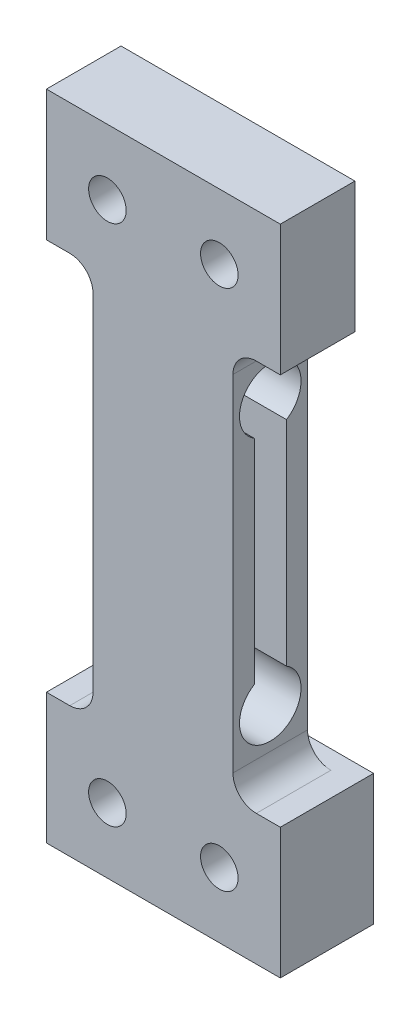
from build123d import *

# Parameters (mm, degrees)
SKETCH1_W           = 12.538434267
SKETCH1_H           = 35
BOSS_EXTRUDE1_DEPTH = 4
SKETCH2_W           = 2.538434267
SKETCH2_H           = 21
CUT_EXTRUDE1_DEPTH  = 37.619666847
SKETCH3_W           = 2.5
SKETCH3_H           = 21
CUT_EXTRUDE2_DEPTH  = 37.619666847
CUT_EXTRUDE3_DEPTH  = 37.619666847
SKETCH5_W           = 7.5
SKETCH5_H           = 1.65
SKETCH6_W           = 7.5
SKETCH6_H           = 1.65
HOLE1_D             = 2.013
FILLET1_R           = 1.25
SKETCH9_W           = 12.538434267
SKETCH9_H           = 7
BOSS_EXTRUDE2_DEPTH = 1


with BuildPart() as part:
    # Sketch1 → Boss-Extrude1 (new body)
    with BuildSketch(Plane(origin=(0, 0, 0), x_dir=(-1, 0, 0), z_dir=(0, 0, -1))):
        with Locations((3.730782867, 17.5)):
            Rectangle(SKETCH1_W, SKETCH1_H)
    extrude(amount=-BOSS_EXTRUDE1_DEPTH)

    # Sketch2 → Cut-Extrude1 (cut, through all)
    with BuildSketch(Plane.XY.offset(4)):
        with Locations((1.269217133, 17.5)):
            Rectangle(SKETCH2_W, SKETCH2_H)
    extrude(amount=-CUT_EXTRUDE1_DEPTH, mode=Mode.SUBTRACT)

    # Sketch3 → Cut-Extrude2 (cut, through all)
    with BuildSketch(Plane.XY.offset(4)):
        with Locations((-8.75, 17.5)):
            Rectangle(SKETCH3_W, SKETCH3_H)
    extrude(amount=-CUT_EXTRUDE2_DEPTH, mode=Mode.SUBTRACT)

    # Sketch4 → Cut-Extrude3 (cut, through all)
    with BuildSketch(Plane(origin=(0, 0, 0), x_dir=(0, 0, -1), z_dir=(1, 0, 0))):
        with BuildLine():
            Line((-2.855933763, 23.21436986), (-2.855933763, 11.78563014))
            ThreePointArc((-2.855933763, 11.78563014), (-1.992824856, 12.024984399), (-1.13183027, 11.778132681))
            Line((-1.13183027, 11.778132681), (-1.13183027, 23.221867319))
            ThreePointArc((-1.13183027, 23.221867319), (-1.992824856, 22.975015601), (-2.855933763, 23.21436986))
        make_face()
    extrude(amount=-CUT_EXTRUDE3_DEPTH, mode=Mode.SUBTRACT)

    # Sketch5 → Cut-Revolve1 (revolve, cut)
    with BuildSketch(Plane.XY.offset(2)):
        with Locations((-3.75, 11.2)):
            Rectangle(SKETCH5_W, SKETCH5_H)
    revolve(axis=Axis((-7.5, 10.375, 2), (1, 0, 0)), mode=Mode.SUBTRACT)

    # Sketch6 → Cut-Revolve2 (revolve, cut)
    with BuildSketch(Plane.XY.offset(2)):
        with Locations((-3.75, 25.45)):
            Rectangle(SKETCH6_W, SKETCH6_H)
    revolve(axis=Axis((-7.5, 24.625, 2), (1, 0, 0)), mode=Mode.SUBTRACT)

    # Hole1 (through all)
    with Locations(Plane(origin=(0, 0, 0), x_dir=(-1, 0, 0), z_dir=(0, 0, -1))):
        with Locations((0.730782866, 3.5), (6.730782866, 3.5), (0.730782866, 31.5), (6.730782866, 31.5)):
            Hole(HOLE1_D / 2)

    # Fillet1
    fillet1_edges = [part.edges().sort_by_distance(p)[0] for p in [
        (0, 7, 2),
        (0, 28, 2),
        (-7.5, 28, 2),
        (-7.5, 7, 2),
    ]]
    fillet(fillet1_edges, radius=FILLET1_R)

    # Sketch9 → Boss-Extrude2 (add)
    with BuildSketch(Plane(origin=(0, 0, 0), x_dir=(-1, 0, 0), z_dir=(0, 0, -1))):
        with Locations((3.730782867, 3.5)):
            Rectangle(SKETCH9_W, SKETCH9_H)
    extrude(amount=BOSS_EXTRUDE2_DEPTH)


solid = part.part
